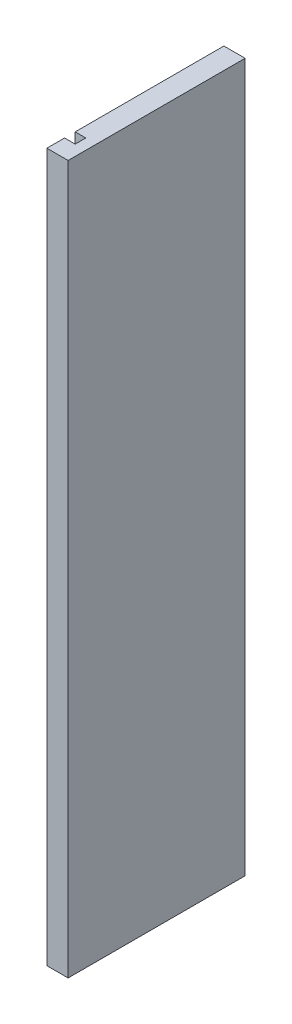
from build123d import *

# Parameters (mm, degrees)
SALIENTE_EXTRUIR2_DEPTH = 400


with BuildPart() as part:
    # Croquis1 → Saliente-Extruir2 (new body)
    with BuildSketch(Plane(origin=(0, 0, 0), x_dir=(1, 0, 0), z_dir=(0, 1, 0))):
        Polygon((12, 24.24476895), (12, -75.75523105), (0, -75.75523105), (0, -65.75523105), (6, -65.75523105), (6, -59.75523105), (0, -59.75523105), (0, 24.24476895), align=None)
    extrude(amount=SALIENTE_EXTRUIR2_DEPTH)


solid = part.part
